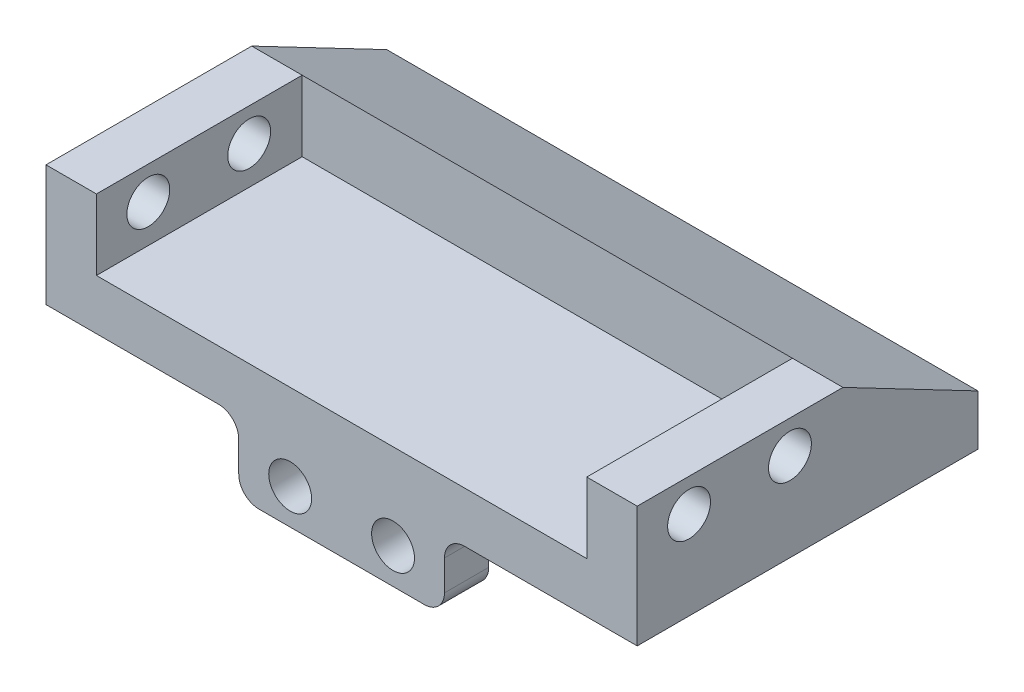
from build123d import *

# Parameters (mm, degrees)
SKETCH1_W                  = 58.6
SKETCH1_H                  = 20.38979341
BRACKETBASE_DEPTH          = 5
SKETCH2_W                  = 20.38979341
SKETCH2_H                  = 12
LEGMOUNTINGTAB_DEPTH       = 5
SKETCH3_R                  = 2.125
LEGMOUNTINGHOLES_DEPTH     = 5
SKETCH4_W                  = 20.38979341
SKETCH4_H                  = 7
ARDUINOMOUNTINGTAB_DEPTH   = 4.38979341
SKETCH5_R                  = 2.125
ARDUINOMOUNTINGHOLES_DEPTH = 5
FILLET1_R                  = 2
BOSS_EXTRUDE1_DEPTH        = 13.38979341
SKETCH7_R                  = 2.125
BOSS_EXTRUDE2_DEPTH        = 4.38979341
CUT_EXTRUDE1_DEPTH         = 69.695127089
CUT_EXTRUDE1_DEPTH_BACK    = 69.695127089
BOSS_EXTRUDE3_DEPTH        = 58.6


with BuildPart() as part:
    # Sketch1 → bracketBase (new body)
    with BuildSketch(Plane(origin=(0, 0, 0), x_dir=(1, 0, 0), z_dir=(0, 1, 0))):
        with Locations((29.3, 10.194896705)):
            Rectangle(SKETCH1_W, SKETCH1_H)
    extrude(amount=BRACKETBASE_DEPTH)

    # Sketch2 → legMountingTab (add)
    with BuildSketch(Plane.ZY):
        with Locations((-10.194896705, 6)):
            Rectangle(SKETCH2_W, SKETCH2_H)
    legmountingtab = extrude(amount=-LEGMOUNTINGTAB_DEPTH)

    # Sketch3 → legMountingHoles (cut)
    with BuildSketch(Plane(origin=(5, 0, 0), x_dir=(0, 0, -1), z_dir=(1, 0, 0))):
        with Locations((15.13979341, 8.75)):
            Circle(SKETCH3_R)
        with Locations((5.13979341, 8.75)):
            Circle(SKETCH3_R)
    legmountingholes = extrude(amount=-LEGMOUNTINGHOLES_DEPTH, mode=Mode.SUBTRACT)

    # legMountingHoles2: legMountingTab, legMountingHoles across plane
    add(legmountingtab.mirror(Plane.ZY.offset(-29.3)))
    add(legmountingholes.mirror(Plane.ZY.offset(-29.3)), mode=Mode.SUBTRACT)

    # Sketch4 → arduinoMountingTab (add)
    with BuildSketch(Plane.XY):
        with Locations((29.3, -3.5)):
            Rectangle(SKETCH4_W, SKETCH4_H)
    extrude(amount=-ARDUINOMOUNTINGTAB_DEPTH)

    # Sketch5 → arduinoMountingHoles (cut)
    with BuildSketch(Plane.XY):
        with Locations((34.397448352, -3.5)):
            Circle(SKETCH5_R)
        with Locations(Location((24.202551647, -3.5, 0), (0, 0, 180))):
            Circle(SKETCH5_R)
    extrude(amount=-ARDUINOMOUNTINGHOLES_DEPTH, mode=Mode.SUBTRACT)

    # Fillet1
    fillet1_edges = [part.edges().sort_by_distance(p)[0] for p in [
        (39.494896705, 0, -2.194896705),
        (39.494896705, -7, -2.194896705),
        (19.105103295, -7, -2.194896705),
        (19.105103295, 0, -2.194896705),
    ]]
    fillet(fillet1_edges, radius=FILLET1_R)

    # Sketch6 → Boss-Extrude1 (add)
    with BuildSketch(Plane(origin=(0, 0, -20.38979341), x_dir=(-1, 0, 0), z_dir=(0, 0, -1))):
        Polygon((-5, 5), (-53.6, 5), (-53.6, 12), (-58.6, 12), (-58.6, 0), (0, 0), (0, 12), (-5, 12), align=None)
    extrude(amount=BOSS_EXTRUDE1_DEPTH)

    # Sketch7 → Boss-Extrude2 (add)
    with BuildSketch(Plane(origin=(0, 0, -33.77958682), x_dir=(-1, 0, 0), z_dir=(0, 0, -1))):
        with BuildLine():
            Line((-37.494896705, -7), (-21.105103295, -7))
            ThreePointArc((-21.105103295, -7), (-19.690889733, -6.414213562), (-19.105103295, -5))
            Line((-19.105103295, -5), (-19.105103295, -2))
            ThreePointArc((-19.105103295, -2), (-18.519316857, -0.585786438), (-17.105103295, 0))
            Line((-17.105103295, 0), (-41.494896705, 0))
            ThreePointArc((-41.494896705, 0), (-40.080683143, -0.585786438), (-39.494896705, -2))
            Line((-39.494896705, -2), (-39.494896705, -5))
            ThreePointArc((-39.494896705, -5), (-38.909110267, -6.414213562), (-37.494896705, -7))
        make_face()
        with Locations(Location((-34.397448352, -3.5, 0), (0, 0, 180))):
            Circle(SKETCH7_R, mode=Mode.SUBTRACT)
        with Locations((-24.202551647, -3.5)):
            Circle(SKETCH7_R, mode=Mode.SUBTRACT)
    extrude(amount=-BOSS_EXTRUDE2_DEPTH)

    # Sketch8 → Cut-Extrude1 (cut, two sides: drawn at the far end of the back side and taken through both)
    with BuildSketch(Plane(origin=(58.6, 0, 0), x_dir=(0, 0, -1), z_dir=(1, 0, 0)).offset(-CUT_EXTRUDE1_DEPTH_BACK)):
        Polygon((20.38979341, 12), (33.77958682, 5), (33.77958682, 12), align=None)
    extrude(amount=CUT_EXTRUDE1_DEPTH + CUT_EXTRUDE1_DEPTH_BACK, mode=Mode.SUBTRACT)

    # Sketch9 → Boss-Extrude3 (add)
    with BuildSketch(Plane.ZY):
        Polygon((-20.38979341, 12), (-20.38979341, 5), (-33.77958682, 5), align=None)
    extrude(amount=-BOSS_EXTRUDE3_DEPTH)


solid = part.part
